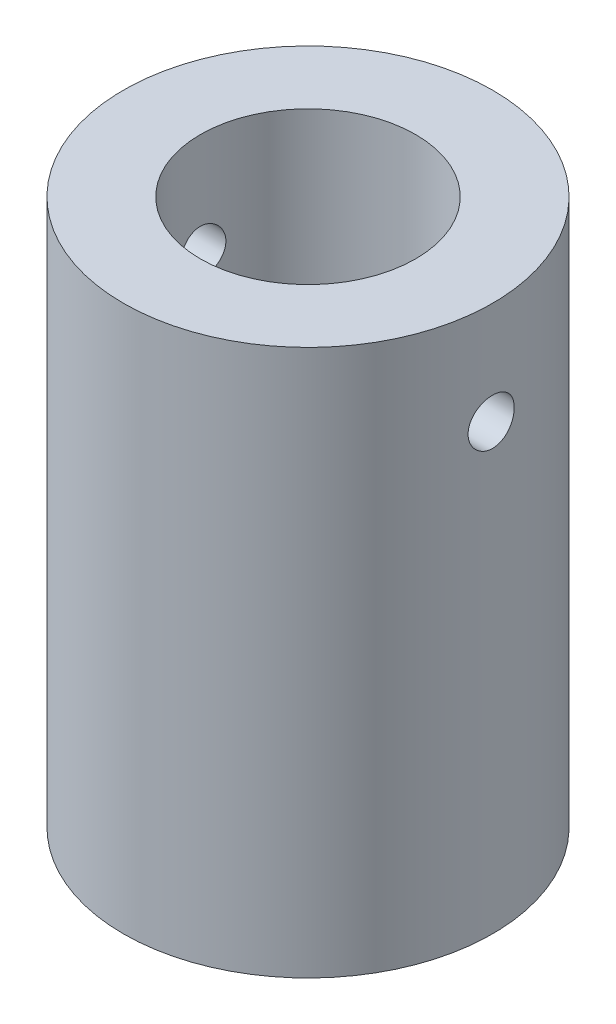
from build123d import *

# Parameters (mm, degrees)
SKETCH_1_R          = 12
SKETCH_1_R_2        = 8
EXTRUDE_1_DEPTH     = 7.5
SKETCH_2_R          = 12
EXTRUDE_2_DEPTH     = 28
CUT_EXTRUDE_3_DEPTH = 11
SKETCH_4_R          = 7
CUT_EXTRUDE_4_DEPTH = 16
SKETCH_5_R          = 1.5
CUT_EXTRUDE_5_DEPTH = 30


with BuildPart() as part:
    # Эскиз1 → Вытянуть1 (new body)
    with BuildSketch(Plane(origin=(0, 0, 0), x_dir=(1, 0, 0), z_dir=(0, 1, 0))):
        with Locations(Location((0, 0, 0), (0, 0, 270))):
            Circle(SKETCH_1_R)
        with Locations(Location((0, 0, 0), (0, 0, 270))):
            Circle(SKETCH_1_R_2, mode=Mode.SUBTRACT)
    extrude(amount=EXTRUDE_1_DEPTH)

    # Эскиз2 → Вытянуть2 (add)
    with BuildSketch(Plane(origin=(0, 7.5, 0), x_dir=(1, 0, 0), z_dir=(0, 1, 0))):
        with Locations(Location((0, 0, 0), (0, 0, 270))):
            Circle(SKETCH_2_R)
    extrude(amount=EXTRUDE_2_DEPTH)

    # Эскиз3 → Вытянуть3 (cut)
    with BuildSketch(Plane.XZ.offset(-7.5)):
        Polygon((4.675379912, 1.625060824), (-1.625060824, 4.675379912), (-4.675379912, -1.625060824), (1.625060824, -4.675379912), align=None)
    extrude(amount=-CUT_EXTRUDE_3_DEPTH, mode=Mode.SUBTRACT)

    # Эскиз4 → Вытянуть4 (cut)
    with BuildSketch(Plane(origin=(0, 35.5, 0), x_dir=(1, 0, 0), z_dir=(0, 1, 0))):
        with Locations(Location((0, 0, 0), (0, 0, 270))):
            Circle(SKETCH_4_R)
    extrude(amount=-CUT_EXTRUDE_4_DEPTH, mode=Mode.SUBTRACT)

    # Эскиз5 → Вытянуть5 (cut, symmetric)
    with BuildSketch(Plane(origin=(0, 0, 0), x_dir=(0, 0, -1), z_dir=(1, 0, 0))):
        with Locations((0, 28.831403322)):
            Circle(SKETCH_5_R)
    extrude(amount=CUT_EXTRUDE_5_DEPTH, both=True, mode=Mode.SUBTRACT)


solid = part.part
